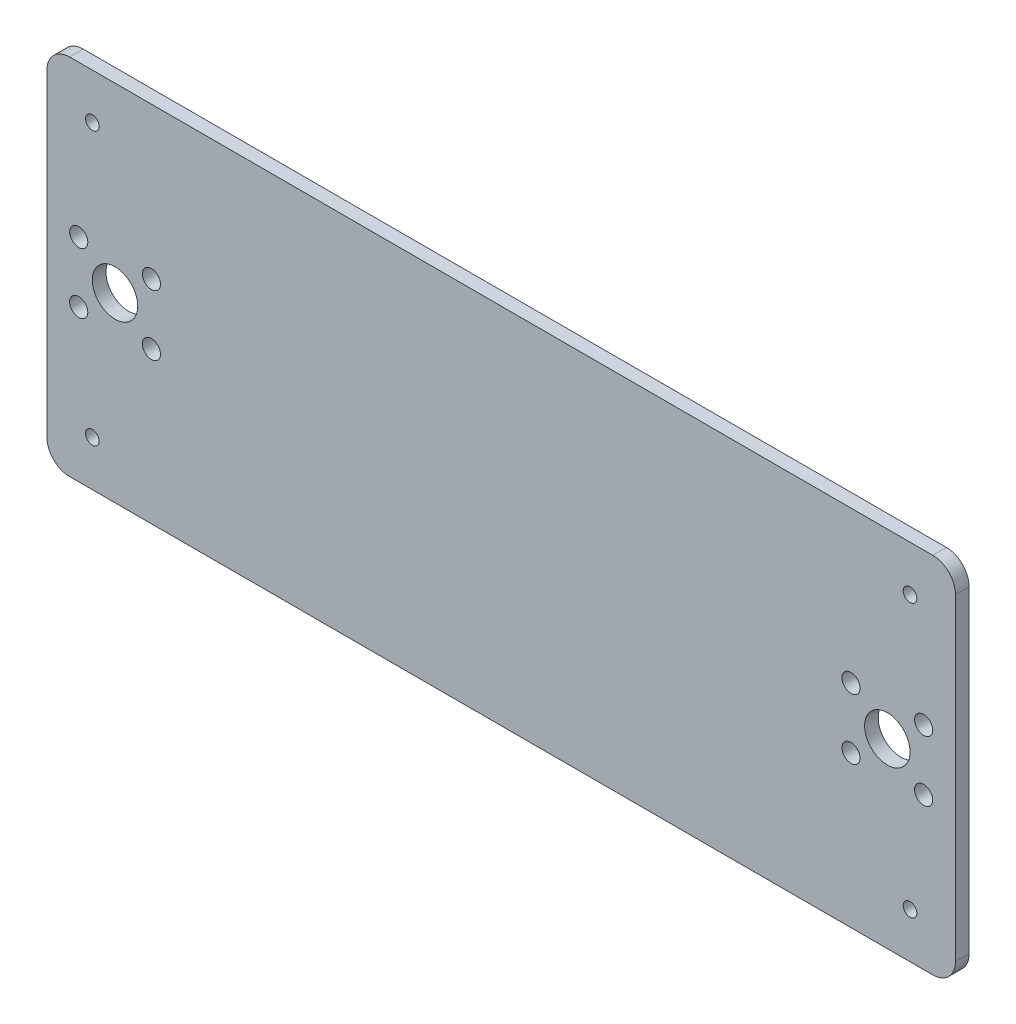
from build123d import *

# Parameters (mm, degrees)
ESBO_O1_R                = 1.5
ESBO_O1_R_2              = 5
ESBO_O1_R_3              = 2
RESSALTO_EXTRUS_O1_DEPTH = 3


with BuildPart() as part:
    # Esboço1 → Ressalto-extrusão1 (new body)
    with BuildSketch(Plane.XY):
        with BuildLine():
            Line((95, -40), (-95, -40))
            ThreePointArc((-95, -40), (-98.535533906, -38.535533906), (-100, -35))
            Line((-100, -35), (-100, 35))
            ThreePointArc((-100, 35), (-98.535533906, 38.535533906), (-95, 40))
            Line((-95, 40), (95, 40))
            ThreePointArc((95, 40), (98.535533906, 38.535533906), (100, 35))
            Line((100, 35), (100, -35))
            ThreePointArc((100, -35), (98.535533906, -38.535533906), (95, -40))
        make_face()
        with Locations((-90, 30)):
            Circle(ESBO_O1_R, mode=Mode.SUBTRACT)
        with Locations((90, 30)):
            Circle(ESBO_O1_R, mode=Mode.SUBTRACT)
        with Locations((90, -30)):
            Circle(ESBO_O1_R, mode=Mode.SUBTRACT)
        with Locations((-90, -30)):
            Circle(ESBO_O1_R, mode=Mode.SUBTRACT)
        with Locations((-85, 0)):
            Circle(ESBO_O1_R_2, mode=Mode.SUBTRACT)
        with Locations((85, 0)):
            Circle(ESBO_O1_R_2, mode=Mode.SUBTRACT)
        with Locations((93, 6.67)):
            Circle(ESBO_O1_R_3, mode=Mode.SUBTRACT)
        with Locations((93, -6.67)):
            Circle(ESBO_O1_R_3, mode=Mode.SUBTRACT)
        with Locations(Location((77, -6.67, 0), (0, 0, 180))):
            Circle(ESBO_O1_R_3, mode=Mode.SUBTRACT)
        with Locations(Location((77, 6.67, 0), (0, 0, 180))):
            Circle(ESBO_O1_R_3, mode=Mode.SUBTRACT)
        with Locations((-77, -6.67)):
            Circle(ESBO_O1_R_3, mode=Mode.SUBTRACT)
        with Locations(Location((-93, -6.67, 0), (0, 0, 180))):
            Circle(ESBO_O1_R_3, mode=Mode.SUBTRACT)
        with Locations(Location((-93, 6.67, 0), (0, 0, 180))):
            Circle(ESBO_O1_R_3, mode=Mode.SUBTRACT)
        with Locations((-77, 6.67)):
            Circle(ESBO_O1_R_3, mode=Mode.SUBTRACT)
    extrude(amount=RESSALTO_EXTRUS_O1_DEPTH)


solid = part.part
